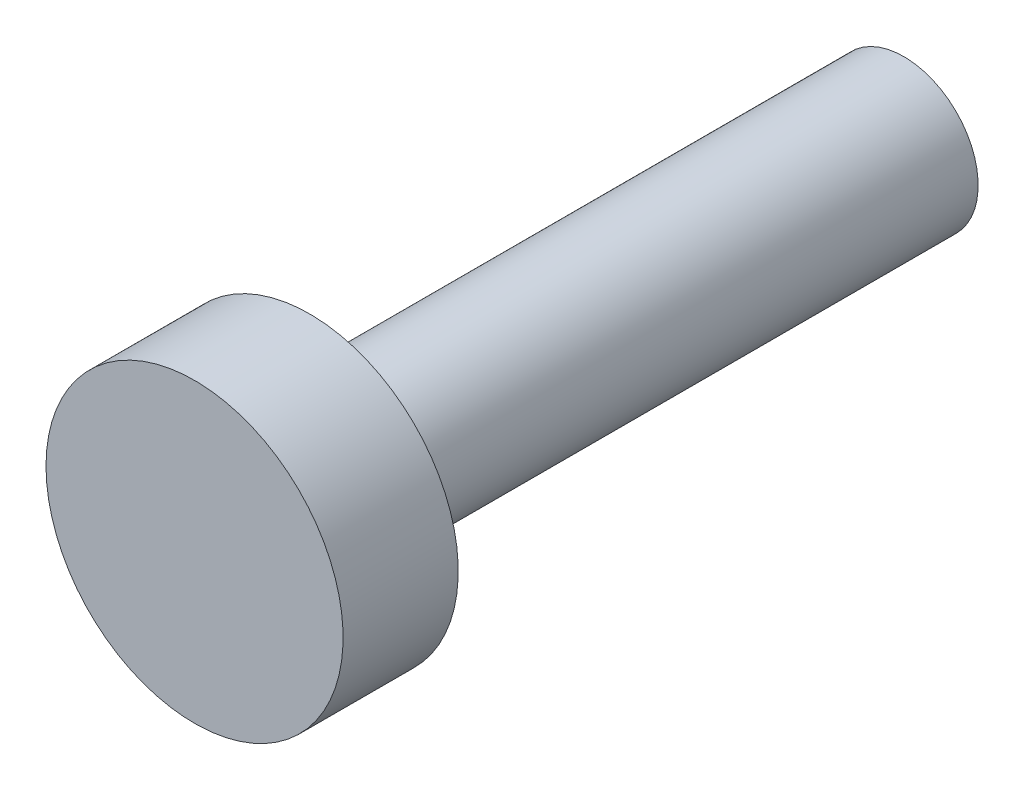
from build123d import *

# Parameters (mm, degrees)
ESQUISSE1_R        = 4
BOSS_EXTRU_1_DEPTH = 3.1
ESQUISSE2_R        = 2
BOSS_EXTRU_2_DEPTH = 16


with BuildPart() as part:
    # Esquisse1 → Boss.-Extru.1 (new body)
    with BuildSketch(Plane.XY):
        with Locations(Location((0, 0, 0), (0, 0, 180))):
            Circle(ESQUISSE1_R)
    extrude(amount=BOSS_EXTRU_1_DEPTH)

    # Esquisse2 → Boss.-Extru.2 (add)
    with BuildSketch(Plane(origin=(0, 0, 0), x_dir=(-1, 0, 0), z_dir=(0, 0, -1))):
        Circle(ESQUISSE2_R)
    extrude(amount=BOSS_EXTRU_2_DEPTH)


solid = part.part
